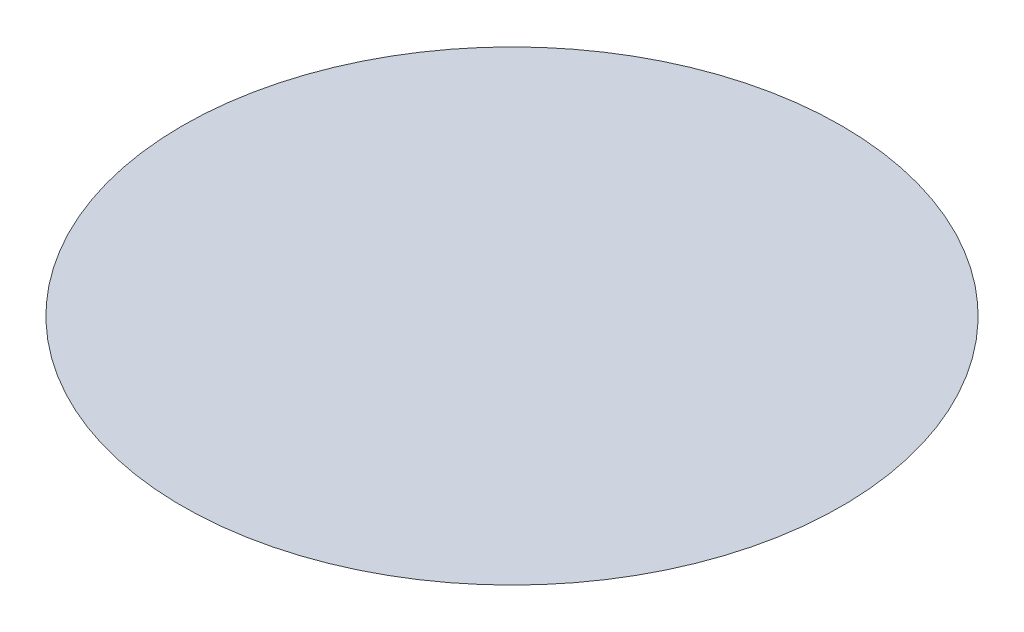
from build123d import *


with BuildPart() as part:
    # Sketch1 → Revolve1 (revolve)
    with BuildSketch(Plane.XY, mode=Mode.PRIVATE) as revolve1_sk:
        with BuildLine():
            Line((0, 0), (0, 32))
            Line((0, 32), (108.524651577, 32))
            ThreePointArc((108.524651577, 32), (56.572077918, 8.166717341), (0, 0))
        make_face()
    revolve(revolve1_sk.sketch.rotate(Axis((0, 0, 0), (0, 1, 0)), 180), axis=Axis((0, 0, 0), (0, 1, 0)))


solid = part.part
